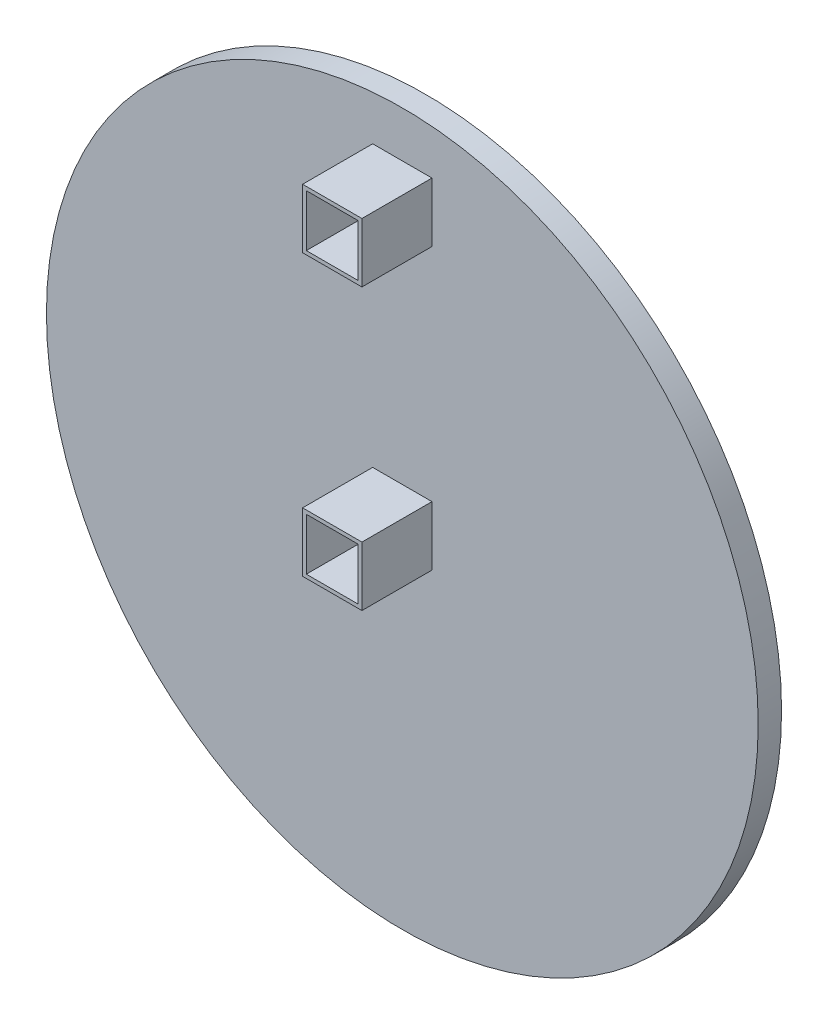
from build123d import *

# Parameters (mm, degrees)
SKETCH1_R           = 152.4
BOSS_EXTRUDE1_DEPTH = 10
SKETCH2_W           = 25.4
SKETCH2_H           = 25.4
SKETCH2_W_2         = 22.225
SKETCH2_H_2         = 22.225
BOSS_EXTRUDE2_DEPTH = 30


with BuildPart() as part:
    # Sketch1 → Boss-Extrude1 (new body)
    with BuildSketch(Plane.XY):
        Circle(SKETCH1_R)
    extrude(amount=BOSS_EXTRUDE1_DEPTH)

    # Sketch2 → Boss-Extrude2 (add)
    # profile 1 of 2: a face of its own
    with BuildSketch(Plane.XY.offset(10)):
        Rectangle(SKETCH2_W, SKETCH2_H)
        Rectangle(SKETCH2_W_2, SKETCH2_H_2, mode=Mode.SUBTRACT)
    # profile 2 of 2: a face of its own
    with BuildSketch(Plane.XY.offset(10)):
        with Locations((0, 120)):
            Rectangle(SKETCH2_W, SKETCH2_H)
        with Locations((0, 120)):
            Rectangle(SKETCH2_W_2, SKETCH2_H_2, mode=Mode.SUBTRACT)
    extrude(amount=BOSS_EXTRUDE2_DEPTH)


solid = part.part
